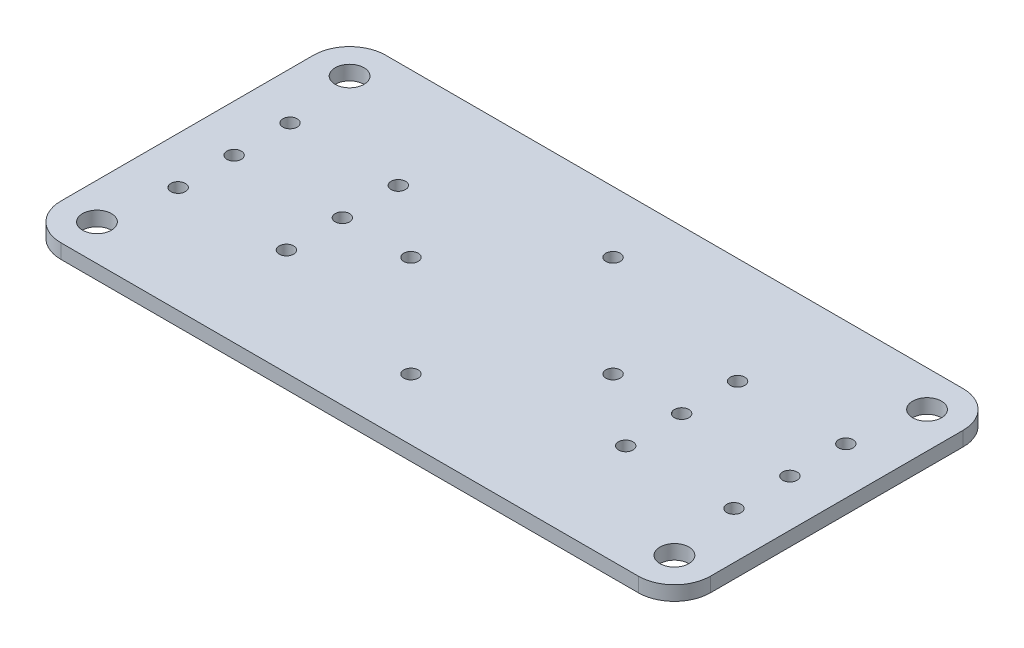
from build123d import *

# Parameters (mm, degrees)
CROQUIS2_W              = 180
CROQUIS2_H              = 90
SALIENTE_EXTRUIR1_DEPTH = 4
REDONDEO1_R             = 10
CORTAR_EXTRUIR1_REACH   = 102.703
CROQUIS8_R              = 2
CORTAR_EXTRUIR2_REACH   = 102.703
CROQUIS4_R              = 4
CROQUIS9_R              = 2
CORTAR_EXTRUIR3_DEPTH   = 101.702532242


with BuildPart() as part:
    # Croquis2 → Saliente-Extruir1 (new body)
    with BuildSketch(Plane(origin=(0, 0, 0), x_dir=(1, 0, 0), z_dir=(0, 1, 0))):
        Rectangle(CROQUIS2_W, CROQUIS2_H)
    extrude(amount=SALIENTE_EXTRUIR1_DEPTH)

    # Redondeo1
    redondeo1_edges = [part.edges().sort_by_distance(p)[0] for p in [
        (90, 2, 45),
        (-90, 2, 45),
        (-90, 2, -45),
        (90, 2, -45),
    ]]
    fillet(redondeo1_edges, radius=REDONDEO1_R)

    # Croquis8 → Cortar-Extruir1 (cut, up to next)
    with BuildSketch(Plane(origin=(0, 4, 0), x_dir=(1, 0, 0), z_dir=(0, 1, 0)), mode=Mode.PRIVATE) as cortar_extruir1_sk1:
        with Locations(Location((-47, 0, 0), (0, 0, 270))):
            Circle(CROQUIS8_R)
    cortar_extruir1_tool1 = extrude(cortar_extruir1_sk1.sketch, amount=-CORTAR_EXTRUIR1_REACH, mode=Mode.PRIVATE) & part.part
    # Croquis8 → Cortar-Extruir1 (cut, up to next)
    with BuildSketch(Plane(origin=(0, 4, 0), x_dir=(1, 0, 0), z_dir=(0, 1, 0)), mode=Mode.PRIVATE) as cortar_extruir1_sk2:
        with Locations(Location((-77, 0, 0), (0, 0, 270))):
            Circle(CROQUIS8_R)
    cortar_extruir1_tool2 = extrude(cortar_extruir1_sk2.sketch, amount=-CORTAR_EXTRUIR1_REACH, mode=Mode.PRIVATE) & part.part
    # Croquis8 → Cortar-Extruir1 (cut, up to next)
    with BuildSketch(Plane(origin=(0, 4, 0), x_dir=(1, 0, 0), z_dir=(0, 1, 0)), mode=Mode.PRIVATE) as cortar_extruir1_sk3:
        with Locations(Location((77, 0, 0), (0, 0, 90))):
            Circle(CROQUIS8_R)
    cortar_extruir1_tool3 = extrude(cortar_extruir1_sk3.sketch, amount=-CORTAR_EXTRUIR1_REACH, mode=Mode.PRIVATE) & part.part
    # Croquis8 → Cortar-Extruir1 (cut, up to next)
    with BuildSketch(Plane(origin=(0, 4, 0), x_dir=(1, 0, 0), z_dir=(0, 1, 0)), mode=Mode.PRIVATE) as cortar_extruir1_sk4:
        with Locations(Location((47, 0, 0), (0, 0, 90))):
            Circle(CROQUIS8_R)
    cortar_extruir1_tool4 = extrude(cortar_extruir1_sk4.sketch, amount=-CORTAR_EXTRUIR1_REACH, mode=Mode.PRIVATE) & part.part
    # Croquis8 → Cortar-Extruir1 (cut, up to next)
    with BuildSketch(Plane(origin=(0, 4, 0), x_dir=(1, 0, 0), z_dir=(0, 1, 0)), mode=Mode.PRIVATE) as cortar_extruir1_sk5:
        with Locations(Location((-77, 15.5, 0), (0, 0, 270))):
            Circle(CROQUIS8_R)
    cortar_extruir1_tool5 = extrude(cortar_extruir1_sk5.sketch, amount=-CORTAR_EXTRUIR1_REACH, mode=Mode.PRIVATE) & part.part
    # Croquis8 → Cortar-Extruir1 (cut, up to next)
    with BuildSketch(Plane(origin=(0, 4, 0), x_dir=(1, 0, 0), z_dir=(0, 1, 0)), mode=Mode.PRIVATE) as cortar_extruir1_sk6:
        with Locations(Location((-47, 15.5, 0), (0, 0, 270))):
            Circle(CROQUIS8_R)
    cortar_extruir1_tool6 = extrude(cortar_extruir1_sk6.sketch, amount=-CORTAR_EXTRUIR1_REACH, mode=Mode.PRIVATE) & part.part
    # Croquis8 → Cortar-Extruir1 (cut, up to next)
    with BuildSketch(Plane(origin=(0, 4, 0), x_dir=(1, 0, 0), z_dir=(0, 1, 0)), mode=Mode.PRIVATE) as cortar_extruir1_sk7:
        with Locations(Location((-77, -15.5, 0), (0, 0, 90))):
            Circle(CROQUIS8_R)
    cortar_extruir1_tool7 = extrude(cortar_extruir1_sk7.sketch, amount=-CORTAR_EXTRUIR1_REACH, mode=Mode.PRIVATE) & part.part
    # Croquis8 → Cortar-Extruir1 (cut, up to next)
    with BuildSketch(Plane(origin=(0, 4, 0), x_dir=(1, 0, 0), z_dir=(0, 1, 0)), mode=Mode.PRIVATE) as cortar_extruir1_sk8:
        with Locations(Location((-47, -15.5, 0), (0, 0, 90))):
            Circle(CROQUIS8_R)
    cortar_extruir1_tool8 = extrude(cortar_extruir1_sk8.sketch, amount=-CORTAR_EXTRUIR1_REACH, mode=Mode.PRIVATE) & part.part
    # Croquis8 → Cortar-Extruir1 (cut, up to next)
    with BuildSketch(Plane(origin=(0, 4, 0), x_dir=(1, 0, 0), z_dir=(0, 1, 0)), mode=Mode.PRIVATE) as cortar_extruir1_sk9:
        with Locations(Location((47, -15.5, 0), (0, 0, 270))):
            Circle(CROQUIS8_R)
    cortar_extruir1_tool9 = extrude(cortar_extruir1_sk9.sketch, amount=-CORTAR_EXTRUIR1_REACH, mode=Mode.PRIVATE) & part.part
    # Croquis8 → Cortar-Extruir1 (cut, up to next)
    with BuildSketch(Plane(origin=(0, 4, 0), x_dir=(1, 0, 0), z_dir=(0, 1, 0)), mode=Mode.PRIVATE) as cortar_extruir1_sk10:
        with Locations(Location((77, -15.5, 0), (0, 0, 270))):
            Circle(CROQUIS8_R)
    cortar_extruir1_tool10 = extrude(cortar_extruir1_sk10.sketch, amount=-CORTAR_EXTRUIR1_REACH, mode=Mode.PRIVATE) & part.part
    # Croquis8 → Cortar-Extruir1 (cut, up to next)
    with BuildSketch(Plane(origin=(0, 4, 0), x_dir=(1, 0, 0), z_dir=(0, 1, 0)), mode=Mode.PRIVATE) as cortar_extruir1_sk11:
        with Locations(Location((77, 15.5, 0), (0, 0, 90))):
            Circle(CROQUIS8_R)
    cortar_extruir1_tool11 = extrude(cortar_extruir1_sk11.sketch, amount=-CORTAR_EXTRUIR1_REACH, mode=Mode.PRIVATE) & part.part
    # Croquis8 → Cortar-Extruir1 (cut, up to next)
    with BuildSketch(Plane(origin=(0, 4, 0), x_dir=(1, 0, 0), z_dir=(0, 1, 0)), mode=Mode.PRIVATE) as cortar_extruir1_sk12:
        with Locations(Location((47, 15.5, 0), (0, 0, 90))):
            Circle(CROQUIS8_R)
    cortar_extruir1_tool12 = extrude(cortar_extruir1_sk12.sketch, amount=-CORTAR_EXTRUIR1_REACH, mode=Mode.PRIVATE) & part.part
    add(cortar_extruir1_tool1.solids().sort_by_distance((-47, 4, 0))[0], mode=Mode.SUBTRACT)
    add(cortar_extruir1_tool2.solids().sort_by_distance((-77, 4, 0))[0], mode=Mode.SUBTRACT)
    add(cortar_extruir1_tool3.solids().sort_by_distance((77, 4, 0))[0], mode=Mode.SUBTRACT)
    add(cortar_extruir1_tool4.solids().sort_by_distance((47, 4, 0))[0], mode=Mode.SUBTRACT)
    add(cortar_extruir1_tool5.solids().sort_by_distance((-77, 4, -15.5))[0], mode=Mode.SUBTRACT)
    add(cortar_extruir1_tool6.solids().sort_by_distance((-47, 4, -15.5))[0], mode=Mode.SUBTRACT)
    add(cortar_extruir1_tool7.solids().sort_by_distance((-77, 4, 15.5))[0], mode=Mode.SUBTRACT)
    add(cortar_extruir1_tool8.solids().sort_by_distance((-47, 4, 15.5))[0], mode=Mode.SUBTRACT)
    add(cortar_extruir1_tool9.solids().sort_by_distance((47, 4, 15.5))[0], mode=Mode.SUBTRACT)
    add(cortar_extruir1_tool10.solids().sort_by_distance((77, 4, 15.5))[0], mode=Mode.SUBTRACT)
    add(cortar_extruir1_tool11.solids().sort_by_distance((77, 4, -15.5))[0], mode=Mode.SUBTRACT)
    add(cortar_extruir1_tool12.solids().sort_by_distance((47, 4, -15.5))[0], mode=Mode.SUBTRACT)

    # Croquis4 → Cortar-Extruir2 (cut, up to next)
    with BuildSketch(Plane(origin=(0, 4, 0), x_dir=(1, 0, 0), z_dir=(0, 1, 0)), mode=Mode.PRIVATE) as cortar_extruir2_sk1:
        with Locations(Location((-80, 35, 0), (0, 0, 270))):
            Circle(CROQUIS4_R)
    cortar_extruir2_tool1 = extrude(cortar_extruir2_sk1.sketch, amount=-CORTAR_EXTRUIR2_REACH, mode=Mode.PRIVATE) & part.part
    # Croquis4 → Cortar-Extruir2 (cut, up to next)
    with BuildSketch(Plane(origin=(0, 4, 0), x_dir=(1, 0, 0), z_dir=(0, 1, 0)), mode=Mode.PRIVATE) as cortar_extruir2_sk2:
        with Locations(Location((-80, -35, 0), (0, 0, 270))):
            Circle(CROQUIS4_R)
    cortar_extruir2_tool2 = extrude(cortar_extruir2_sk2.sketch, amount=-CORTAR_EXTRUIR2_REACH, mode=Mode.PRIVATE) & part.part
    # Croquis4 → Cortar-Extruir2 (cut, up to next)
    with BuildSketch(Plane(origin=(0, 4, 0), x_dir=(1, 0, 0), z_dir=(0, 1, 0)), mode=Mode.PRIVATE) as cortar_extruir2_sk3:
        with Locations(Location((80, -35, 0), (0, 0, 90))):
            Circle(CROQUIS4_R)
    cortar_extruir2_tool3 = extrude(cortar_extruir2_sk3.sketch, amount=-CORTAR_EXTRUIR2_REACH, mode=Mode.PRIVATE) & part.part
    # Croquis4 → Cortar-Extruir2 (cut, up to next)
    with BuildSketch(Plane(origin=(0, 4, 0), x_dir=(1, 0, 0), z_dir=(0, 1, 0)), mode=Mode.PRIVATE) as cortar_extruir2_sk4:
        with Locations(Location((80, 35, 0), (0, 0, 90))):
            Circle(CROQUIS4_R)
    cortar_extruir2_tool4 = extrude(cortar_extruir2_sk4.sketch, amount=-CORTAR_EXTRUIR2_REACH, mode=Mode.PRIVATE) & part.part
    add(cortar_extruir2_tool1.solids().sort_by_distance((-80, 4, -35))[0], mode=Mode.SUBTRACT)
    add(cortar_extruir2_tool2.solids().sort_by_distance((-80, 4, 35))[0], mode=Mode.SUBTRACT)
    add(cortar_extruir2_tool3.solids().sort_by_distance((80, 4, 35))[0], mode=Mode.SUBTRACT)
    add(cortar_extruir2_tool4.solids().sort_by_distance((80, 4, -35))[0], mode=Mode.SUBTRACT)

    # Croquis9 → Cortar-Extruir3 (cut, through all)
    with BuildSketch(Plane(origin=(0, 4, 0), x_dir=(1, 0, 0), z_dir=(0, 1, 0))):
        with Locations(Location((0, 28, 0), (0, 0, 270))):
            Circle(CROQUIS9_R)
        with Locations(Location((-28, 0, 0), (0, 0, 270))):
            Circle(CROQUIS9_R)
        with Locations(Location((0, -28, 0), (0, 0, 90))):
            Circle(CROQUIS9_R)
        with Locations(Location((28, 0, 0), (0, 0, 90))):
            Circle(CROQUIS9_R)
    extrude(amount=-CORTAR_EXTRUIR3_DEPTH, mode=Mode.SUBTRACT)


solid = part.part
